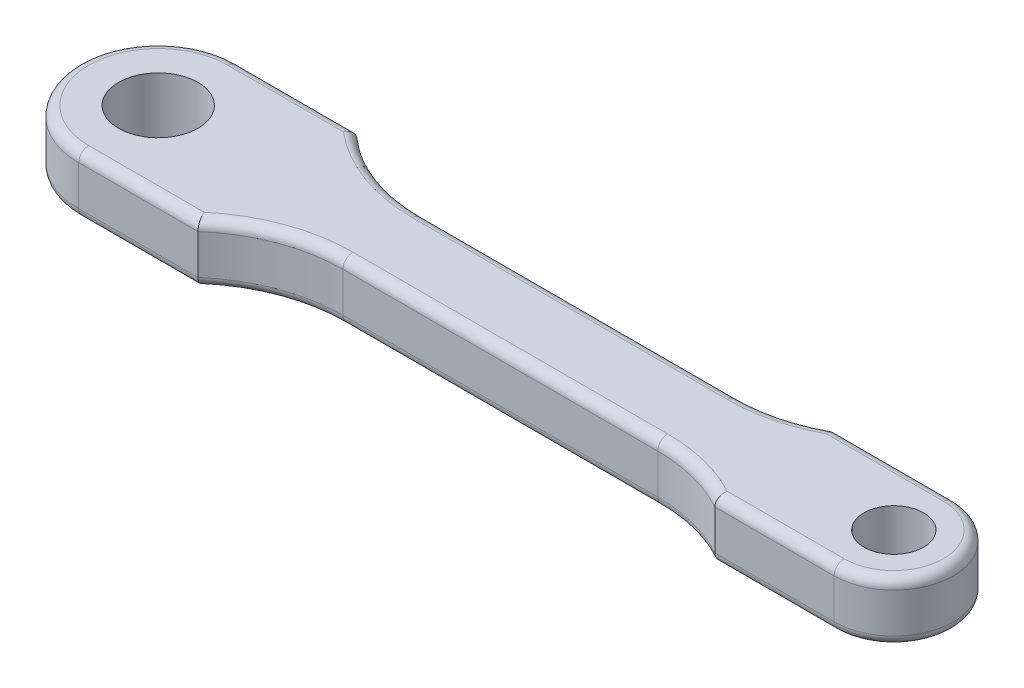
from build123d import *

# Parameters (mm, degrees)
SKETCH1_R           = 2
SKETCH1_R_2         = 1.5
BOSS_EXTRUDE1_DEPTH = 1.5
SCALE1_SCALE        = 1.5
FILLET1_R           = 0.75


with BuildPart() as part:
    # Sketch1 → Boss-Extrude1 (new, symmetric)
    with BuildSketch(Plane(origin=(0, 0, 0), x_dir=(1, 0, 0), z_dir=(0, 1, 0))):
        with BuildLine():
            ThreePointArc((-18.5, 4), (-22.5, 0), (-18.5, -4))
            Line((-18.5, -4), (-12.5, -4))
            ThreePointArc((-12.5, -4), (-10.036924503, -2.516685226), (-7.208497378, -2))
            Line((-7.208497378, -2), (8.627016654, -2))
            ThreePointArc((8.627016654, -2), (10.627016654, -2.254033308), (12.5, -3))
            Line((12.5, -3), (18.5, -3))
            ThreePointArc((18.5, -3), (21.5, 0), (18.5, 3))
            Line((18.5, 3), (12.5, 3))
            ThreePointArc((12.5, 3), (10.627016654, 2.254033308), (8.627016654, 2))
            Line((8.627016654, 2), (-7.208497378, 2))
            ThreePointArc((-7.208497378, 2), (-10.036924503, 2.516685226), (-12.5, 4))
            Line((-12.5, 4), (-18.5, 4))
        make_face()
        with Locations(Location((-18.5, 0, 0), (0, 0, 270))):
            Circle(SKETCH1_R, mode=Mode.SUBTRACT)
        with Locations(Location((18.5, 0, 0), (0, 0, 270))):
            Circle(SKETCH1_R_2, mode=Mode.SUBTRACT)
    extrude(amount=BOSS_EXTRUDE1_DEPTH, both=True)


with BuildPart() as part_1:
    # Scale1: scaled about (-1.682409561, 0, 0)
    add(part.part.scale(SCALE1_SCALE).moved(Location((0.841204781, 0, 0))))

    # Fillet1
    fillet1_edges = [part_1.edges().sort_by_distance(p)[0] for p in [
        (33.09120478, 2.25, 0),
        (24.091204781, 2.25, -4.5),
        (16.781729761, -2.25, 3.381049961),
        (1.905094237, -2.25, 3),
        (-14.214181973, -2.25, 3.77502784),
        (-22.408795219, -2.25, 6),
        (-32.908795219, -2.25, 0),
        (-22.408795219, -2.25, -6),
        (-14.214181973, -2.25, -3.77502784),
        (1.905094237, -2.25, -3),
        (16.781729761, -2.25, -3.381049961),
        (24.091204781, -2.25, -4.5),
        (16.781729761, 2.25, -3.381049961),
        (33.09120478, -2.25, 0),
        (24.091204781, -2.25, 4.5),
        (1.905094237, 2.25, -3),
        (-14.214181973, 2.25, -3.77502784),
        (-22.408795219, 2.25, -6),
        (-32.908795219, 2.25, 0),
        (-22.408795219, 2.25, 6),
        (-14.214181973, 2.25, 3.77502784),
        (1.905094237, 2.25, 3),
        (16.781729761, 2.25, 3.381049961),
        (24.091204781, 2.25, 4.5),
    ]]
    fillet(fillet1_edges, radius=FILLET1_R)


solid = part_1.part
